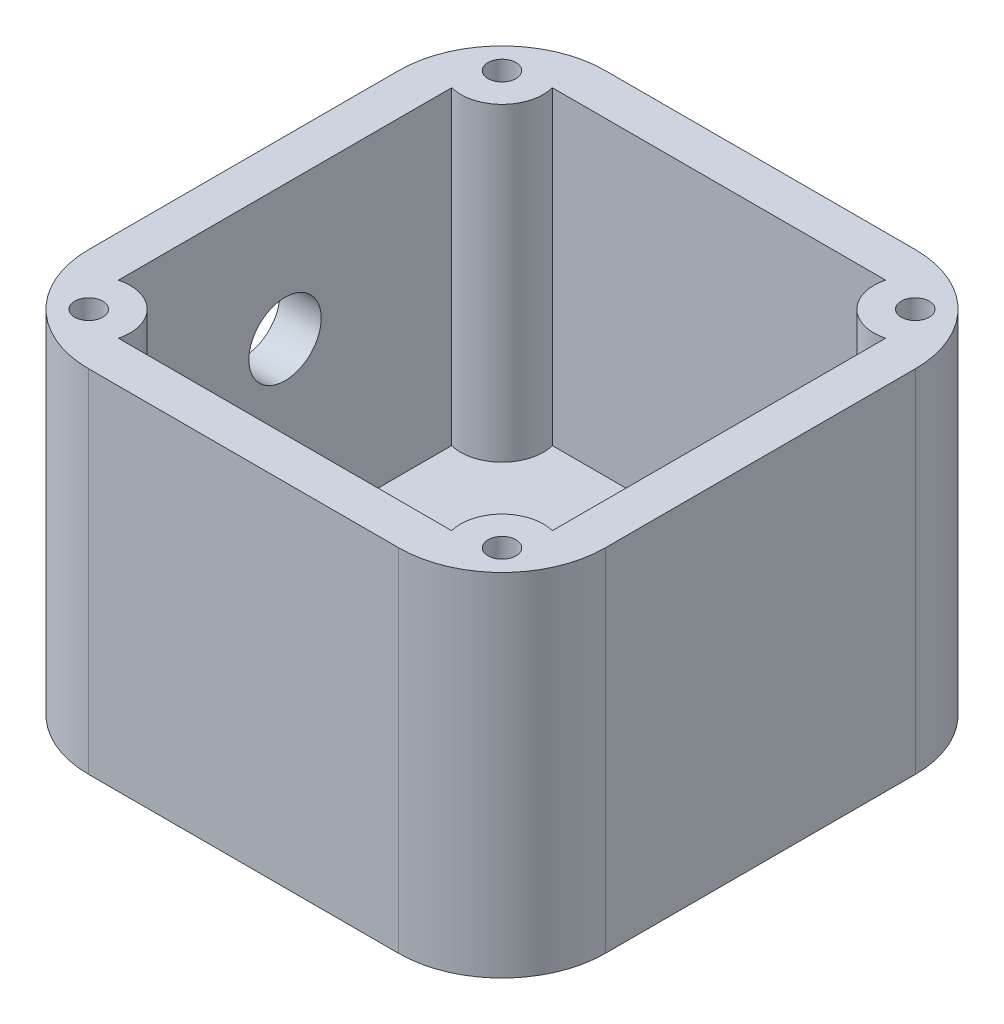
from build123d import *

# Parameters (mm, degrees)
SKETCH1_W                 = 42
SKETCH1_H                 = 42
BOSS_EXTRUDE2_DEPTH       = 30
SHELL1_T                  = 4
SKETCH3_R                 = 3.5
CUT_EXTRUDE1_DEPTH        = 30
SKETCH2_R                 = 6.75
CUT_EXTRUDE2_DEPTH        = 30
SKETCH5_R                 = 4
BOSS_EXTRUDE3_DEPTH       = 34
F_6_32_TAPPED_HOLE6_D     = 2.7051
F_6_32_TAPPED_HOLE6_DEPTH = 10.97
F_6_32_TAPPED_HOLE6_TIP   = 0.81269403
FILLET3_R                 = 10


with BuildPart() as part:
    # Sketch1 → Boss-Extrude2 (new body)
    with BuildSketch(Plane(origin=(0, 0, 0), x_dir=(1, 0, 0), z_dir=(0, 1, 0))):
        Rectangle(SKETCH1_W, SKETCH1_H)
    extrude(amount=BOSS_EXTRUDE2_DEPTH)

    # Shell1
    shell1_openings = [part.faces().sort_by_distance(p)[0] for p in [
        (0, 30, 0),
    ]]
    offset(amount=SHELL1_T, openings=shell1_openings, kind=Kind.INTERSECTION)

    # Sketch3 → Cut-Extrude1 (cut)
    with BuildSketch(Plane(origin=(0, 0, 0), x_dir=(0, 0, -1), z_dir=(1, 0, 0))):
        with Locations((0, 17)):
            Circle(SKETCH3_R)
    extrude(amount=-CUT_EXTRUDE1_DEPTH, mode=Mode.SUBTRACT)

    # Sketch2 → Cut-Extrude2 (cut)
    with BuildSketch(Plane(origin=(0, -4, 0), x_dir=(-1, 0, 0), z_dir=(0, -1, 0))):
        with Locations(Location((0, 0, 0), (0, 0, 90))):
            Circle(SKETCH2_R)
    extrude(amount=-CUT_EXTRUDE2_DEPTH, mode=Mode.SUBTRACT)

    # Sketch5 → Boss-Extrude3 (add)
    with BuildSketch(Plane(origin=(0, -4, 0), x_dir=(-1, 0, 0), z_dir=(0, -1, 0))):
        with Locations((20, -20)):
            Circle(SKETCH5_R)
        with Locations((-20, -20)):
            Circle(SKETCH5_R)
        with Locations((-20, 20)):
            Circle(SKETCH5_R)
        with Locations((20, 20)):
            Circle(SKETCH5_R)
    extrude(amount=-BOSS_EXTRUDE3_DEPTH)

    # #6-32 Tapped Hole6
    with Locations(Plane(origin=(-20, 30, -20), x_dir=(0, 0, 1), z_dir=(0, 1, 0))):
        with Locations((0, 0), (0, 40), (40, 40), (40, 0)):
            Hole(F_6_32_TAPPED_HOLE6_D / 2, depth=F_6_32_TAPPED_HOLE6_DEPTH)
            with Locations((0, 0, -(F_6_32_TAPPED_HOLE6_DEPTH + F_6_32_TAPPED_HOLE6_TIP / 2))):  # 118° drill point
                Cone(0, F_6_32_TAPPED_HOLE6_D / 2, F_6_32_TAPPED_HOLE6_TIP, mode=Mode.SUBTRACT)

    # Fillet3
    fillet3_edges = [part.edges().sort_by_distance(p)[0] for p in [
        (25, 13, 25),
        (-25, 13, 25),
        (-25, 13, -25),
        (25, 13, -25),
    ]]
    fillet(fillet3_edges, radius=FILLET3_R)


solid = part.part
